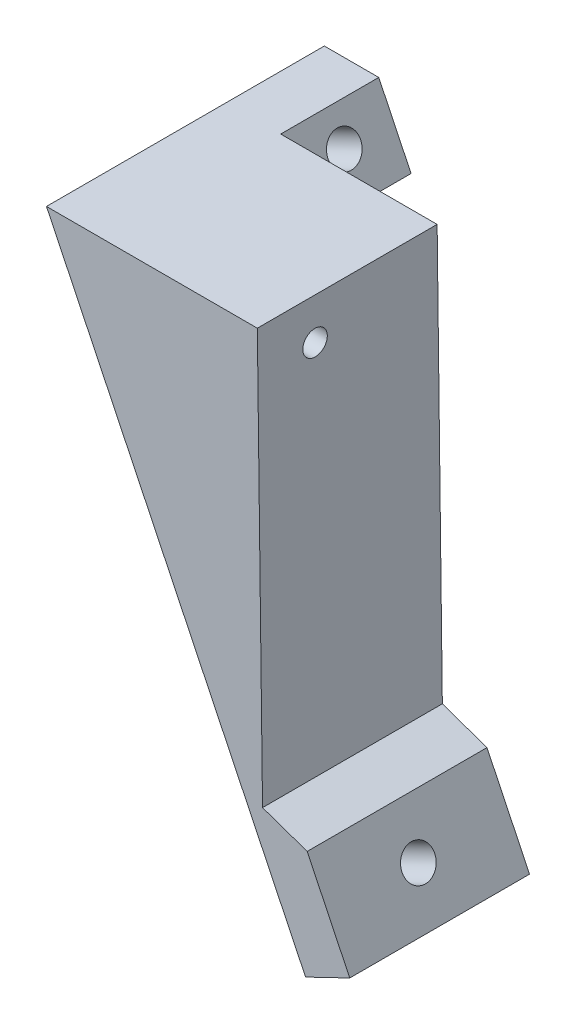
from build123d import *

# Parameters (mm, degrees)
BOSS_EXTRUDE1_DEPTH = 22
SKETCH6_W           = 12
SKETCH6_H           = 12
SKETCH6_W_2         = 22
BOSS_EXTRUDE4_DEPTH = 6
BOSS_EXTRUDE5_DEPTH = 22
SKETCH9_R           = 2
CUT_EXTRUDE9_DEPTH  = 6
SKETCH10_R          = 1.5
CUT_EXTRUDE10_DEPTH = 36
CUT_EXTRUDE11_DEPTH = 36


with BuildPart() as part:
    # Sketch1 → Boss-Extrude1 (new body)
    with BuildSketch(Plane.XY):
        Polygon((-36.238637744, 24.241346543), (-9.742760301, -30.758653457), (-10.435989217, 24.241346543), align=None)
    extrude(amount=BOSS_EXTRUDE1_DEPTH)

    # Sketch6 → Boss-Extrude4 (add)
    with BuildSketch(Plane(origin=(-19.934259386, -9.603194429, 0), x_dir=(0, 0, 1), z_dir=(-0.9009094793526655, -0.4340070391278342, 0))):
        with Locations((-6, 31.567082762)):
            Rectangle(SKETCH6_W, SKETCH6_H)
        with Locations((11, -29.48233592)):
            Rectangle(SKETCH6_W_2, SKETCH6_H)
    extrude(amount=-BOSS_EXTRUDE4_DEPTH)


with BuildPart() as boss_extrude4_piece_1:
    # of the separate pieces the step leaves, piece 1, a body of its own (boss_extrude4_pieces)
    add(part.part.solids().sort_by_distance((-36.238637744, 24.241346543, 0))[0])



with BuildPart() as boss_extrude4_piece_2:
    # of the separate pieces the step leaves, piece 2, a body of its own (boss_extrude4_pieces)
    add(part.part.solids().sort_by_distance((-4.337303425, -28.154611222, 0))[0])


with BuildPart() as boss_extrude4_piece_1_1:
    add(boss_extrude4_piece_1.part)

    add(boss_extrude4_piece_2.part)  # Boss-Extrude5 merges Boss-Extrude4 piece 2
    # Sketch8 → Boss-Extrude5 (add)
    with BuildSketch(Plane(origin=(0, 0, 0), x_dir=(-1, 0, 0), z_dir=(0, 0, -1))):
        Polygon((9.742760301, -30.758653457), (4.337303425, -28.154611222), (9.799620757, -26.247409014), align=None)
    extrude(amount=-BOSS_EXTRUDE5_DEPTH)

    # Sketch9 → Cut-Extrude9 (cut)
    with BuildSketch(Plane(origin=(-14.52880251, -6.999152194, 0), x_dir=(0, 0, -1), z_dir=(0.9009094793526653, 0.43400703912783434, 0))):
        with Locations(Location((6, 30.567082762, 0), (0, 0, 90))):
            Circle(SKETCH9_R)
        with Locations(Location((-11, -29.48233592, 0), (0, 0, 90))):
            Circle(SKETCH9_R)
    extrude(amount=-CUT_EXTRUDE9_DEPTH, mode=Mode.SUBTRACT)

    # Sketch10 → Cut-Extrude10 (cut)
    with BuildSketch(Plane(origin=(-10.128838238, -0.127665519, 0), x_dir=(0, 0, -1), z_dir=(0.9999205770118876, 0.012603161040540517, 0))):
        with Locations(Location((-15, 19.370947675, 0), (0, 0, 90))):
            Circle(SKETCH10_R)
    extrude(amount=-CUT_EXTRUDE10_DEPTH, mode=Mode.SUBTRACT)

    # Sketch11 → Cut-Extrude11 (cut)
    with BuildSketch(Plane.XY):
        Polygon((-36.238637744, 24.241346543), (-29.578701161, 24.241346543), (-30.833180868, 26.845388778), align=None)
    extrude(amount=-CUT_EXTRUDE11_DEPTH, mode=Mode.SUBTRACT)


solid = boss_extrude4_piece_1_1.part
